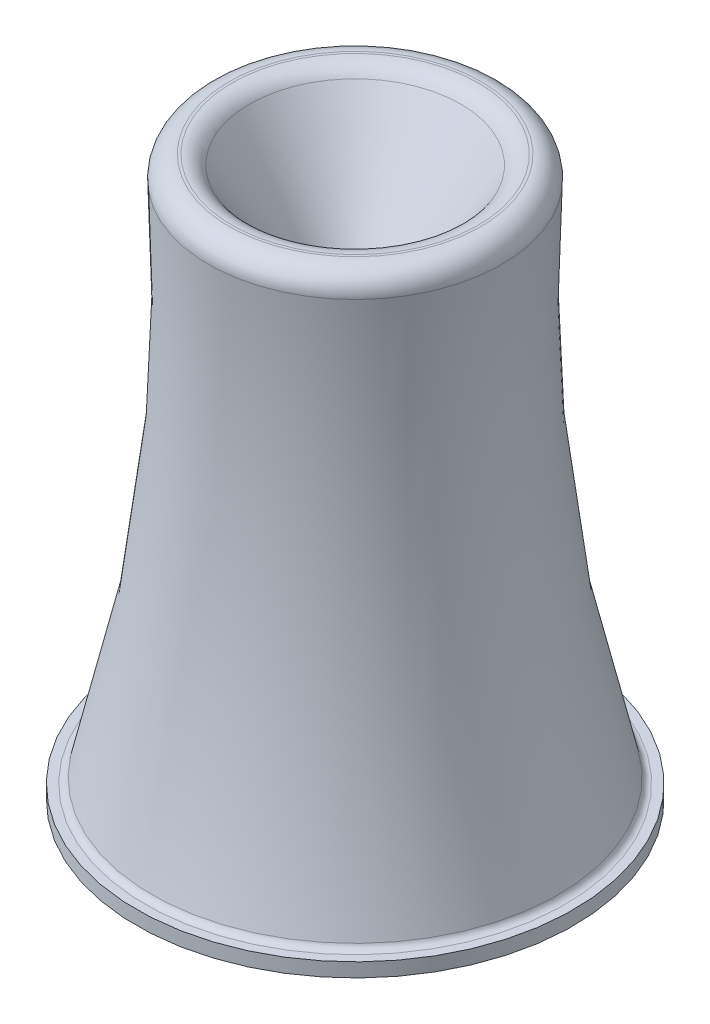
from build123d import *


with BuildPart() as part:
    # Esquisse1 → Révolution3 (revolve)
    with BuildSketch(Plane(origin=(0, 0, 0), x_dir=(0, 0, -1), z_dir=(1, 0, 0))):
        with BuildLine():
            Line((31.25, 0), (28.273835099, 0))
            ThreePointArc((28.273835099, 0), (20.499905423, 38.067161735), (19.497117554, 76.90705362))
            ThreePointArc((19.497117554, 76.90705362), (19.093027806, 78.027273194), (18, 78.5))
            Line((18, 78.5), (17.628058133, 78.5))
            ThreePointArc((17.628058133, 78.5), (16.912594573, 78.318374717), (16.370392708, 77.817482526))
            Line((16.370392708, 77.817482526), (4.789029066, 60))
            Line((4.789029066, 60), (3, 60))
            Line((3, 60), (15.112727284, 78.634965052))
            ThreePointArc((15.112727284, 78.634965052), (16.197131013, 79.636749434), (17.628058133, 80))
            Line((17.628058133, 80), (18, 80))
            ThreePointArc((18, 80), (20.186055613, 79.054546388), (20.994235108, 76.814107239))
            ThreePointArc((20.994235108, 76.814107239), (21.857795657, 39.426427354), (29.041387811, 2.725196477))
            ThreePointArc((29.041387811, 2.725196477), (29.400726908, 2.201625551), (30.002888214, 2))
            Line((30.002888214, 2), (31.25, 2))
            Line((31.25, 2), (31.25, 0))
        make_face()
    revolve(axis=Axis((0, 0, 0), (0, 1, 0)))


solid = part.part
